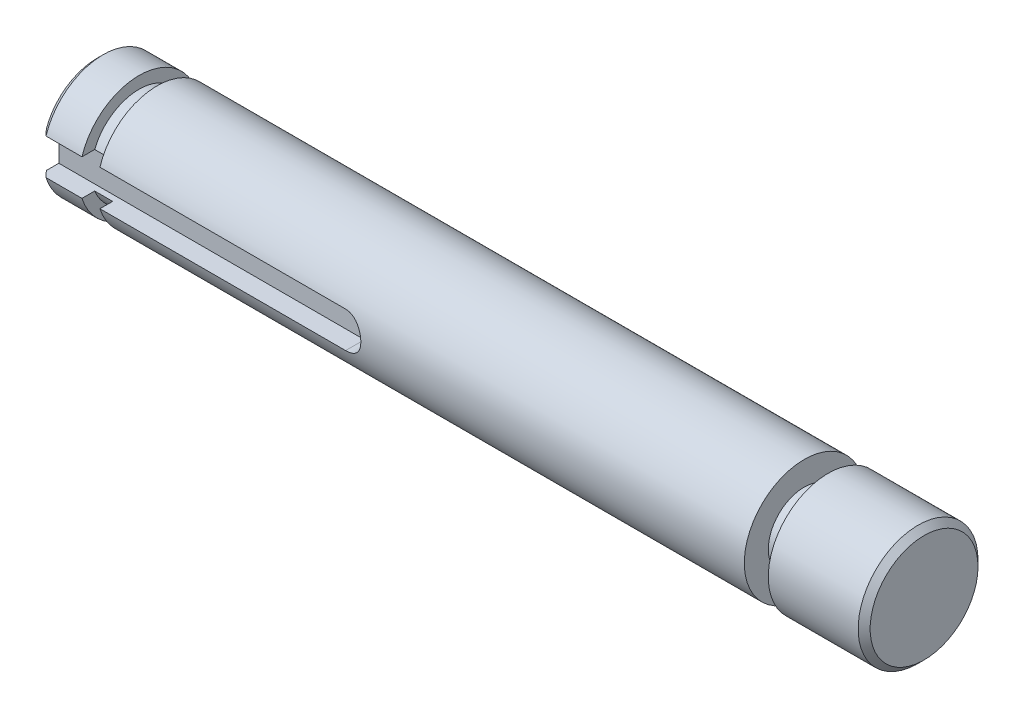
from build123d import *

# Parameters (mm, degrees)
SKETCH1_R           = 5
BOSS_EXTRUDE1_DEPTH = 34.5
CUT_EXTRUDE1_START  = -8
SKETCH3_R           = 5
SKETCH3_R_2         = 3
CUT_EXTRUDE1_DEPTH  = 2
CUT_EXTRUDE2_START  = -5
SKETCH4_R           = 5
SKETCH4_R_2         = 4
CUT_EXTRUDE2_DEPTH  = 1.5
CHAMFER1_SIZE       = 0.5
CUT_EXTRUDE3_START  = 3.2
CUT_EXTRUDE3_DEPTH  = 33.017183306


with BuildPart() as part:
    # Sketch1 → Boss-Extrude1 (new, symmetric)
    with BuildSketch(Plane(origin=(0, 0, 0), x_dir=(0, 0, -1), z_dir=(1, 0, 0))):
        Circle(SKETCH1_R)
    extrude(amount=BOSS_EXTRUDE1_DEPTH, both=True)

    # Sketch3 → Cut-Extrude1 (cut)
    with BuildSketch(Plane(origin=(34.5, 0, 0), x_dir=(0, 0, -1), z_dir=(1, 0, 0)).offset(CUT_EXTRUDE1_START)):
        Circle(SKETCH3_R)
        Circle(SKETCH3_R_2, mode=Mode.SUBTRACT)
    extrude(amount=-CUT_EXTRUDE1_DEPTH, mode=Mode.SUBTRACT)

    # Sketch4 → Cut-Extrude2 (cut)
    with BuildSketch(Plane.ZY.offset(34.5).offset(CUT_EXTRUDE2_START)):
        Circle(SKETCH4_R)
        Circle(SKETCH4_R_2, mode=Mode.SUBTRACT)
    extrude(amount=CUT_EXTRUDE2_DEPTH, mode=Mode.SUBTRACT)

    # Chamfer1
    chamfer1_edges = [part.edges().sort_by_distance(p)[0] for p in [
        (-34.5, 0, 5),
        (34.5, 0, 5),
    ]]
    chamfer(chamfer1_edges, length=CHAMFER1_SIZE)

    # Sketch5 → Cut-Extrude3 (cut, through all)
    with BuildSketch(Plane.XY.offset(CUT_EXTRUDE3_START)):
        with BuildLine():
            Line((-34.5, 1.5), (-34.5, -1.5))
            Line((-34.5, -1.5), (-9, -1.5))
            ThreePointArc((-9, -1.5), (-7.5, 0), (-9, 1.5))
            Line((-9, 1.5), (-34.5, 1.5))
        make_face()
    extrude(amount=CUT_EXTRUDE3_DEPTH, mode=Mode.SUBTRACT)


solid = part.part
